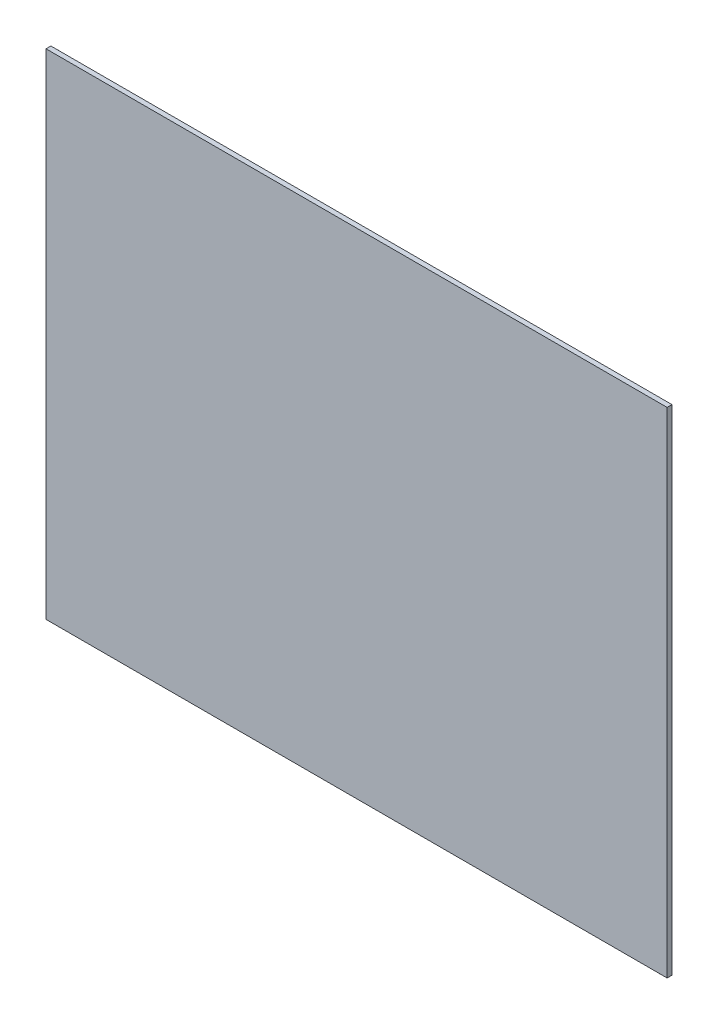
from build123d import *

# Parameters (mm, degrees)
ESQUISSE1_W        = 832
ESQUISSE1_H        = 662
BOSS_EXTRU_1_DEPTH = 6.5


with BuildPart() as part:
    # Esquisse1 → Boss.-Extru.1 (new body)
    with BuildSketch(Plane.XY):
        Rectangle(ESQUISSE1_W, ESQUISSE1_H)
    extrude(amount=BOSS_EXTRU_1_DEPTH)


solid = part.part
